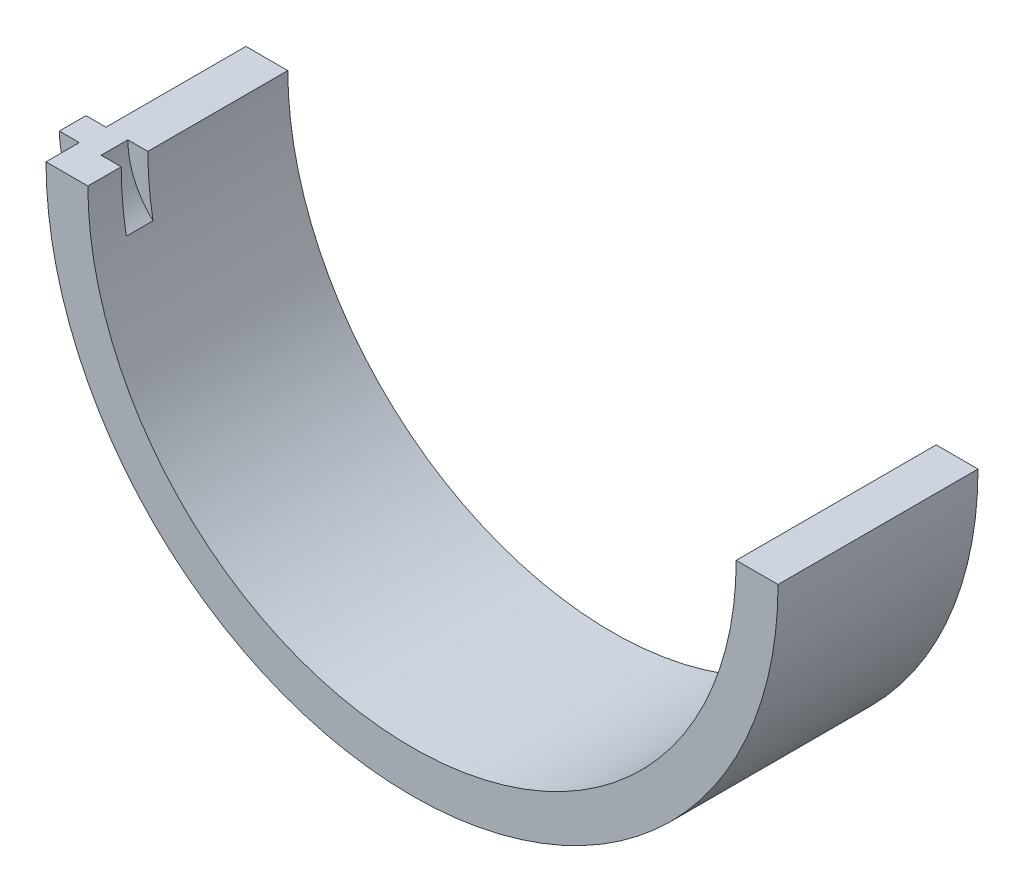
from build123d import *

# Parameters (mm, degrees)
BOSS_EXTRUDE1_DEPTH = 19.05
BOSS_EXTRUDE2_DEPTH = 2.54
CUT_EXTRUDE2_DEPTH  = 2.54


with BuildPart() as part:
    # Sketch1 → Boss-Extrude1 (new body)
    with BuildSketch(Plane.XY):
        with BuildLine():
            Line((-30.8864, 34.8742), (-34.8742, 34.8742))
            ThreePointArc((-34.8742, 34.8742), (0, 0), (34.8742, 34.8742))
            Line((34.8742, 34.8742), (30.8864, 34.8742))
            ThreePointArc((30.8864, 34.8742), (0, 3.9878), (-30.8864, 34.8742))
        make_face()
    extrude(amount=-BOSS_EXTRUDE1_DEPTH)

    # Sketch5 → Boss-Extrude2 (add)
    with BuildSketch(Plane.XY.offset(-3.175)):
        with BuildLine():
            Line((-34.8742, 34.8742), (-36.7792, 34.8742))
            ThreePointArc((-36.7792, 34.8742), (-36.169947499, 31.891654655), (-34.439806621, 29.386983441))
            ThreePointArc((-34.439806621, 29.386983441), (-34.765432039, 32.122008002), (-34.8742, 34.8742))
        make_face()
    extrude(amount=-BOSS_EXTRUDE2_DEPTH)

    # Sketch6 → Cut-Extrude2 (cut)
    with BuildSketch(Plane.XY.offset(-3.175)):
        with BuildLine():
            Line((-30.8864, 34.8742), (-32.7914, 34.8742))
            ThreePointArc((-32.7914, 34.8742), (-32.166190236, 31.880374998), (-30.395068011, 29.386983441))
            ThreePointArc((-30.395068011, 29.386983441), (-30.763321778, 32.119615064), (-30.8864, 34.8742))
        make_face()
    extrude(amount=-CUT_EXTRUDE2_DEPTH, mode=Mode.SUBTRACT)


solid = part.part
